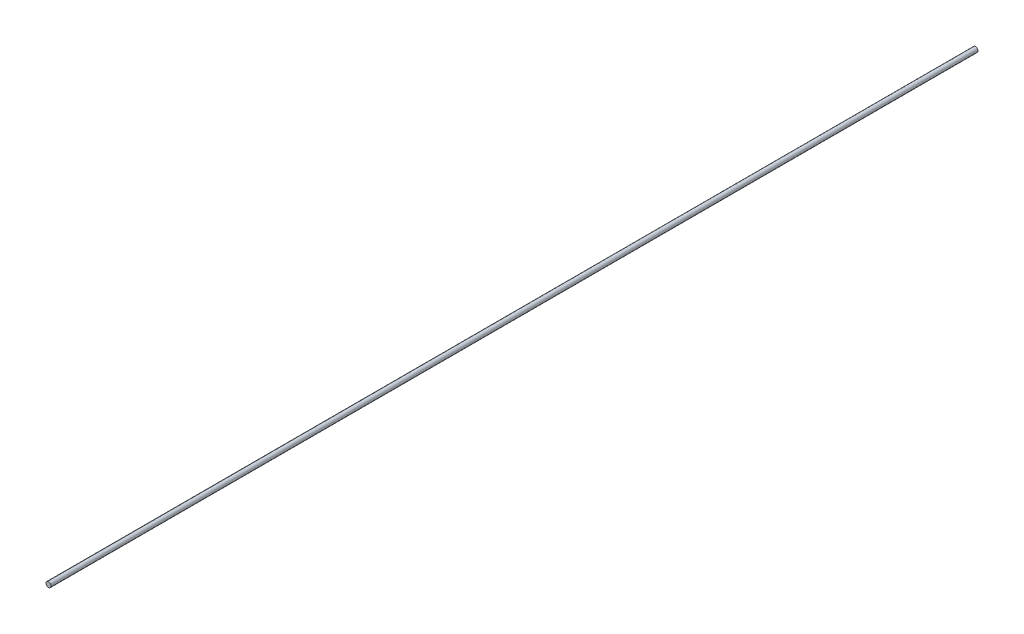
from build123d import *

# Parameters (mm, degrees)
SKETCH1_R           = 5.715
BOSS_EXTRUDE1_DEPTH = 2124.71


with BuildPart() as part:
    # Sketch1 → Boss-Extrude1 (new body)
    with BuildSketch(Plane.XY):
        Circle(SKETCH1_R)
    extrude(amount=BOSS_EXTRUDE1_DEPTH)


solid = part.part
